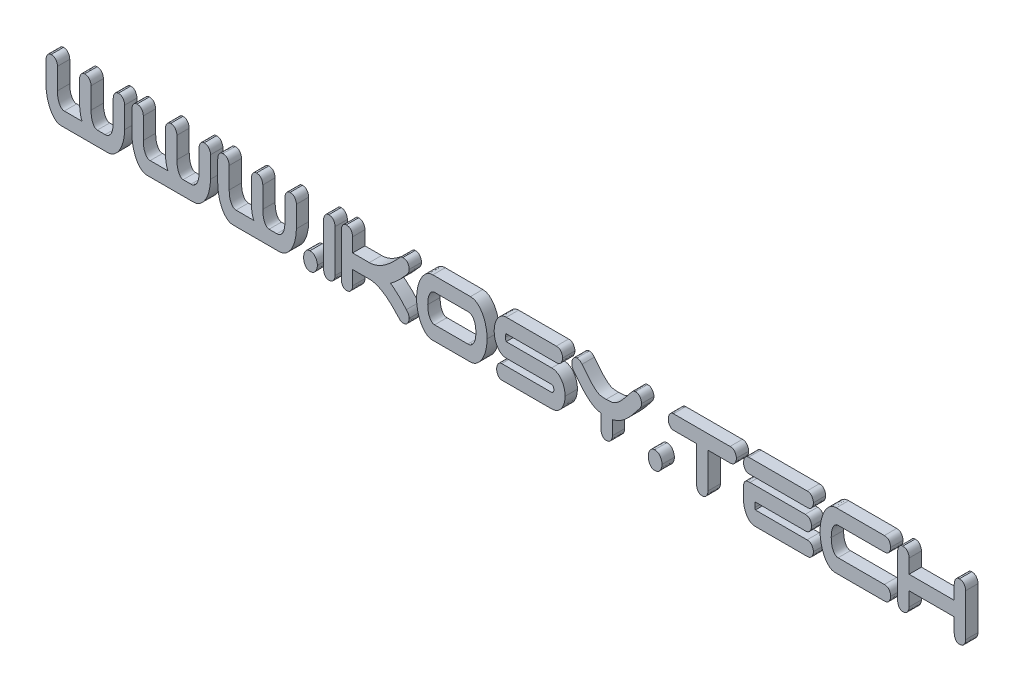
from build123d import *

# Parameters (mm, degrees)
TEXT_EXTRUDE_DEPTH    = 2.5
TEXT_EXTRUDE_2_DEPTH  = 2.5
TEXT_EXTRUDE_3_DEPTH  = 2.5
TEXT_EXTRUDE_4_DEPTH  = 2.5
TEXT_EXTRUDE_5_DEPTH  = 2.5
TEXT_EXTRUDE_6_DEPTH  = 2.5
TEXT_EXTRUDE_7_DEPTH  = 2.5
TEXT_EXTRUDE_8_DEPTH  = 2.5
TEXT_EXTRUDE_9_DEPTH  = 2.5
TEXT_EXTRUDE_10_DEPTH = 2.5
TEXT_EXTRUDE_11_DEPTH = 2.5
TEXT_EXTRUDE_12_DEPTH = 2.5
TEXT_EXTRUDE_13_DEPTH = 2.5
TEXT_EXTRUDE_14_DEPTH = 2.5
TEXT_EXTRUDE_15_DEPTH = 2.5


with BuildPart() as part:
    # Text Sketch → Text Extrude (new body)
    with BuildSketch(Plane.XY):
        with BuildLine():
            add(Edge.make_bspline(
                [(0.084737524, 11.141283215), (0.088352565, 11.235939531), (0.095355865, 11.41931408), (0.148829129, 11.685788598), (0.238517787, 11.933634344), (0.362789339, 12.158902666), (0.516878101, 12.348793883), (0.695846082, 12.494631077), (0.903677782, 12.580852986), (1.050389142, 12.590002964), (1.124432923, 12.594620868)],
                knots=[0, 0, 0, 0, 1.147004837, 2.222054497, 3.279664014, 4.331359947, 5.326320678, 6.227132309, 7.105251108, 8, 8, 8, 8], degree=3))
            add(Edge.make_bspline(
                [(1.124432923, 12.594620868), (1.22813478, 12.589229926), (1.424653741, 12.579013884), (1.700413205, 12.493113534), (1.92785693, 12.338397932), (2.101477364, 12.128612786), (2.230291729, 11.892537388), (2.32961037, 11.647779928), (2.392628094, 11.396609051), (2.399303907, 11.226101408), (2.402624757, 11.141283215)],
                knots=[0, 0, 0, 0, 1.145886374, 2.171498243, 3.151055978, 4.145252637, 5.154343752, 6.11639408, 7.063009444, 8, 8, 8, 8], degree=3))
            Line((2.402624757, 11.141283215), (2.402624757, 6.844620868))
            add(Edge.make_bspline(
                [(2.402624757, 6.844620868), (2.406998695, 6.680565458), (2.415998508, 6.343005117), (2.464729293, 5.835918727), (2.562383062, 5.337666998), (2.727443244, 4.887755853), (2.936044372, 4.511989202), (3.141615293, 4.257933398), (3.330789619, 4.120982482), (3.476577249, 4.049037775), (3.633761548, 4.006535388), (3.741428748, 4.0005978), (3.796338302, 3.997569669)],
                knots=[0, 0, 0, 0, 1.421369808, 2.924609886, 4.408157366, 5.807360525, 7.05526964, 8.123192616, 8.601024659, 9.067825495, 9.524597215, 10, 10, 10, 10], degree=3))
            Line((3.796338302, 3.997569669), (7.429682437, 3.997569669))
            add(Edge.make_bspline(
                [(7.429682437, 3.997569669), (7.386776385, 4.076177759), (7.295400142, 4.243587989), (7.191102799, 4.530216742), (7.097133195, 4.858622744), (7.001720747, 5.360754297), (6.915854345, 6.026960032), (6.90317026, 6.57103053), (6.896791964, 6.844620868)],
                knots=[0, 0, 0, 0, 0.550596351, 1.172595107, 1.872108015, 2.651894347, 4.316377452, 6, 6, 6, 6], degree=3))
            Line((6.896791964, 6.844620868), (6.896791964, 11.141283215))
            add(Edge.make_bspline(
                [(6.896791964, 11.141283215), (6.900407005, 11.235939531), (6.907410304, 11.41931408), (6.960883568, 11.685788598), (7.050572226, 11.933634344), (7.174843778, 12.158902666), (7.328932541, 12.348793883), (7.507900522, 12.494631077), (7.715732221, 12.580852986), (7.862443581, 12.590002964), (7.936487362, 12.594620868)],
                knots=[0, 0, 0, 0, 1.147004837, 2.222054497, 3.279664014, 4.331359947, 5.326320678, 6.227132309, 7.105251108, 8, 8, 8, 8], degree=3))
            add(Edge.make_bspline(
                [(7.936487362, 12.594620868), (8.038940978, 12.589123102), (8.234202286, 12.578645179), (8.508664879, 12.493072245), (8.736457532, 12.338553077), (8.909155664, 12.127536732), (9.043069559, 11.893654548), (9.141420368, 11.647640172), (9.204742512, 11.396643342), (9.211378271, 11.226112799), (9.214679196, 11.141283215)],
                knots=[0, 0, 0, 0, 1.133181501, 2.159674891, 3.140074562, 4.13512574, 5.151897891, 6.114775108, 7.062204094, 8, 8, 8, 8], degree=3))
            Line((9.214679196, 11.141283215), (9.214679196, 6.844620868))
            add(Edge.make_bspline(
                [(9.214679196, 6.844620868), (9.218969063, 6.681807686), (9.227732809, 6.349197491), (9.277176411, 5.849719318), (9.374934527, 5.356174848), (9.503528095, 4.966299997), (9.633740738, 4.683990271), (9.737082153, 4.501801097), (9.845831978, 4.346067703), (9.960563624, 4.217498195), (10.08422143, 4.119076319), (10.214377704, 4.049914121), (10.349855687, 4.007093627), (10.442892003, 4.000732213), (10.489144524, 3.997569669)],
                knots=[0, 0, 0, 0, 1.738006205, 3.550563757, 5.349787416, 7.098028101, 7.916568963, 8.664770571, 9.330559333, 9.940551626, 10.497527359, 11.007556249, 11.506611747, 12, 12, 12, 12], degree=3))
            Line((10.489144524, 3.997569669), (12.076636423, 3.997569669))
            add(Edge.make_bspline(
                [(12.076636423, 3.997569669), (12.153864587, 4.001566188), (12.302470375, 4.009256464), (12.515943266, 4.056390209), (12.704592772, 4.144279474), (12.928150675, 4.303487774), (13.162283373, 4.569497989), (13.383085656, 4.95340022), (13.545835463, 5.400047313), (13.640834764, 5.888402447), (13.695653063, 6.375053437), (13.704619951, 6.694196168), (13.708846403, 6.844620868)],
                knots=[0, 0, 0, 0, 0.636428735, 1.224643805, 1.787762638, 2.338474794, 3.475490099, 4.672300096, 5.970444146, 7.371112152, 8.760900289, 10, 10, 10, 10], degree=3))
            Line((13.708846403, 6.844620868), (13.708846403, 11.141283215))
            add(Edge.make_bspline(
                [(13.708846403, 11.141283215), (13.712461444, 11.235939531), (13.719464744, 11.41931408), (13.772938008, 11.685788598), (13.862626666, 11.933634344), (13.986898218, 12.158902666), (14.14098698, 12.348793883), (14.319954961, 12.494631077), (14.527786661, 12.580852986), (14.674498021, 12.590002964), (14.748541802, 12.594620868)],
                knots=[0, 0, 0, 0, 1.147004837, 2.222054497, 3.279664014, 4.331359947, 5.326320678, 6.227132309, 7.105251108, 8, 8, 8, 8], degree=3))
            add(Edge.make_bspline(
                [(14.748541802, 12.594620868), (14.850995418, 12.589123102), (15.046256725, 12.578645179), (15.320719319, 12.493072245), (15.548511971, 12.338553077), (15.721210104, 12.127536732), (15.855123998, 11.893654548), (15.953474807, 11.647640172), (16.016796951, 11.396643342), (16.02343271, 11.226112799), (16.026733636, 11.141283215)],
                knots=[0, 0, 0, 0, 1.133181501, 2.159674891, 3.140074562, 4.13512574, 5.151897891, 6.114775108, 7.062204094, 8, 8, 8, 8], degree=3))
            Line((16.026733636, 11.141283215), (16.026733636, 6.844620868))
            add(Edge.make_bspline(
                [(16.026733636, 6.844620868), (16.016489461, 6.526023552), (15.995597171, 5.87626621), (15.85735497, 5.069576423), (15.700601674, 4.430075667), (15.560260799, 3.964466993), (15.388495715, 3.523328366), (15.194095749, 3.103366717), (14.976593876, 2.706137232), (14.720625915, 2.33874133), (14.43195493, 1.998538348), (14.116680531, 1.686695974), (13.766603739, 1.416928465), (13.368554403, 1.231174498), (12.934188863, 1.113737221), (12.631430091, 1.101122925), (12.475372651, 1.094620868)],
                knots=[0, 0, 0, 0, 1.799801224, 3.670570972, 4.610410242, 5.520845599, 6.416464605, 7.283311826, 8.134931654, 8.972283627, 9.809105761, 10.653023461, 11.475770373, 12.292173682, 13.11969849, 14, 14, 14, 14], degree=3))
            Line((12.475372651, 1.094620868), (3.229909268, 1.094620868))
            add(Edge.make_bspline(
                [(3.229909268, 1.094620868), (3.102381775, 1.100352979), (2.851506324, 1.111629337), (2.49022145, 1.223212658), (2.1537058, 1.394768889), (1.850696514, 1.640814248), (1.575982747, 1.93476473), (1.321480935, 2.265145564), (1.089382239, 2.629115796), (0.881394693, 3.026951083), (0.702328527, 3.456659083), (0.536626009, 3.905605612), (0.399680486, 4.378043679), (0.247255062, 5.028825565), (0.117382418, 5.853395361), (0.095513516, 6.51741999), (0.084737524, 6.844620868)],
                knots=[0, 0, 0, 0, 0.74818093, 1.47184129, 2.203863704, 2.958156395, 3.754085872, 4.566677148, 5.407838898, 6.290259488, 7.203628613, 8.144381123, 9.103901089, 10.094628626, 12.075612124, 14, 14, 14, 14], degree=3))
            Line((0.084737524, 6.844620868), (0.084737524, 11.141283215))
        make_face()
    extrude(amount=TEXT_EXTRUDE_DEPTH)


with BuildPart() as body_2:
    # Text Sketch → Text Extrude 2 (new body)
    with BuildSketch(Plane.XY):
        with BuildLine():
            add(Edge.make_bspline(
                [(17.494977317, 11.141283215), (17.498592358, 11.235939531), (17.505595657, 11.41931408), (17.559068922, 11.685788598), (17.64875758, 11.933634344), (17.773029132, 12.158902666), (17.927117894, 12.348793883), (18.106085875, 12.494631077), (18.313917575, 12.580852986), (18.460628935, 12.590002964), (18.534672715, 12.594620868)],
                knots=[0, 0, 0, 0, 1.147004837, 2.222054497, 3.279664014, 4.331359947, 5.326320678, 6.227132309, 7.105251108, 8, 8, 8, 8], degree=3))
            add(Edge.make_bspline(
                [(18.534672715, 12.594620868), (18.638374572, 12.589229926), (18.834893533, 12.579013884), (19.110652998, 12.493113534), (19.338096723, 12.338397932), (19.511717156, 12.128612786), (19.640531521, 11.892537388), (19.739850162, 11.647779928), (19.802867887, 11.396609051), (19.809543699, 11.226101408), (19.81286455, 11.141283215)],
                knots=[0, 0, 0, 0, 1.145886374, 2.171498243, 3.151055978, 4.145252637, 5.154343752, 6.11639408, 7.063009444, 8, 8, 8, 8], degree=3))
            Line((19.81286455, 11.141283215), (19.81286455, 6.844620868))
            add(Edge.make_bspline(
                [(19.81286455, 6.844620868), (19.817238487, 6.680565458), (19.8262383, 6.343005117), (19.874969085, 5.835918727), (19.972622855, 5.337666998), (20.137683036, 4.887755853), (20.346284164, 4.511989202), (20.551855085, 4.257933398), (20.741029411, 4.120982482), (20.886817041, 4.049037775), (21.04400134, 4.006535388), (21.15166854, 4.0005978), (21.206578095, 3.997569669)],
                knots=[0, 0, 0, 0, 1.421369808, 2.924609886, 4.408157366, 5.807360525, 7.05526964, 8.123192616, 8.601024659, 9.067825495, 9.524597215, 10, 10, 10, 10], degree=3))
            Line((21.206578095, 3.997569669), (24.839922229, 3.997569669))
            add(Edge.make_bspline(
                [(24.839922229, 3.997569669), (24.797016178, 4.076177759), (24.705639934, 4.243587989), (24.601342591, 4.530216742), (24.507372988, 4.858622744), (24.41196054, 5.360754297), (24.326094138, 6.026960032), (24.313410053, 6.57103053), (24.307031756, 6.844620868)],
                knots=[0, 0, 0, 0, 0.550596351, 1.172595107, 1.872108015, 2.651894347, 4.316377452, 6, 6, 6, 6], degree=3))
            Line((24.307031756, 6.844620868), (24.307031756, 11.141283215))
            add(Edge.make_bspline(
                [(24.307031756, 11.141283215), (24.310646797, 11.235939531), (24.317650097, 11.41931408), (24.371123361, 11.685788598), (24.460812019, 11.933634344), (24.585083571, 12.158902666), (24.739172333, 12.348793883), (24.918140314, 12.494631077), (25.125972014, 12.580852986), (25.272683374, 12.590002964), (25.346727155, 12.594620868)],
                knots=[0, 0, 0, 0, 1.147004837, 2.222054497, 3.279664014, 4.331359947, 5.326320678, 6.227132309, 7.105251108, 8, 8, 8, 8], degree=3))
            add(Edge.make_bspline(
                [(25.346727155, 12.594620868), (25.449180771, 12.589123102), (25.644442078, 12.578645179), (25.918904672, 12.493072245), (26.146697324, 12.338553077), (26.319395457, 12.127536732), (26.453309351, 11.893654548), (26.551660161, 11.647640172), (26.614982304, 11.396643342), (26.621618063, 11.226112799), (26.624918989, 11.141283215)],
                knots=[0, 0, 0, 0, 1.133181501, 2.159674891, 3.140074562, 4.13512574, 5.151897891, 6.114775108, 7.062204094, 8, 8, 8, 8], degree=3))
            Line((26.624918989, 11.141283215), (26.624918989, 6.844620868))
            add(Edge.make_bspline(
                [(26.624918989, 6.844620868), (26.629208856, 6.681807686), (26.637972601, 6.349197491), (26.687416204, 5.849719318), (26.785174319, 5.356174848), (26.913767888, 4.966299997), (27.043980531, 4.683990271), (27.147321946, 4.501801097), (27.25607177, 4.346067703), (27.370803417, 4.217498195), (27.494461222, 4.119076319), (27.624617496, 4.049914121), (27.760095479, 4.007093627), (27.853131795, 4.000732213), (27.899384316, 3.997569669)],
                knots=[0, 0, 0, 0, 1.738006205, 3.550563757, 5.349787416, 7.098028101, 7.916568963, 8.664770571, 9.330559333, 9.940551626, 10.497527359, 11.007556249, 11.506611747, 12, 12, 12, 12], degree=3))
            Line((27.899384316, 3.997569669), (29.486876215, 3.997569669))
            add(Edge.make_bspline(
                [(29.486876215, 3.997569669), (29.56410438, 4.001566188), (29.712710167, 4.009256464), (29.926183058, 4.056390209), (30.114832565, 4.144279474), (30.338390468, 4.303487774), (30.572523165, 4.569497989), (30.793325448, 4.95340022), (30.956075256, 5.400047313), (31.051074557, 5.888402447), (31.105892855, 6.375053437), (31.114859744, 6.694196168), (31.119086196, 6.844620868)],
                knots=[0, 0, 0, 0, 0.636428735, 1.224643805, 1.787762638, 2.338474794, 3.475490099, 4.672300096, 5.970444146, 7.371112152, 8.760900289, 10, 10, 10, 10], degree=3))
            Line((31.119086196, 6.844620868), (31.119086196, 11.141283215))
            add(Edge.make_bspline(
                [(31.119086196, 11.141283215), (31.122701237, 11.235939531), (31.129704536, 11.41931408), (31.1831778, 11.685788598), (31.272866458, 11.933634344), (31.39713801, 12.158902666), (31.551226773, 12.348793883), (31.730194754, 12.494631077), (31.938026453, 12.580852986), (32.084737813, 12.590002964), (32.158781594, 12.594620868)],
                knots=[0, 0, 0, 0, 1.147004837, 2.222054497, 3.279664014, 4.331359947, 5.326320678, 6.227132309, 7.105251108, 8, 8, 8, 8], degree=3))
            add(Edge.make_bspline(
                [(32.158781594, 12.594620868), (32.26123521, 12.589123102), (32.456496518, 12.578645179), (32.730959111, 12.493072245), (32.958751764, 12.338553077), (33.131449896, 12.127536732), (33.265363791, 11.893654548), (33.3637146, 11.647640172), (33.427036744, 11.396643342), (33.433672503, 11.226112799), (33.436973428, 11.141283215)],
                knots=[0, 0, 0, 0, 1.133181501, 2.159674891, 3.140074562, 4.13512574, 5.151897891, 6.114775108, 7.062204094, 8, 8, 8, 8], degree=3))
            Line((33.436973428, 11.141283215), (33.436973428, 6.844620868))
            add(Edge.make_bspline(
                [(33.436973428, 6.844620868), (33.426729254, 6.526023552), (33.405836964, 5.87626621), (33.267594762, 5.069576423), (33.110841467, 4.430075667), (32.970500592, 3.964466993), (32.798735508, 3.523328366), (32.604335542, 3.103366717), (32.386833669, 2.706137232), (32.130865708, 2.33874133), (31.842194723, 1.998538348), (31.526920324, 1.686695974), (31.176843532, 1.416928465), (30.778794196, 1.231174498), (30.344428656, 1.113737221), (30.041669884, 1.101122925), (29.885612443, 1.094620868)],
                knots=[0, 0, 0, 0, 1.799801224, 3.670570972, 4.610410242, 5.520845599, 6.416464605, 7.283311826, 8.134931654, 8.972283627, 9.809105761, 10.653023461, 11.475770373, 12.292173682, 13.11969849, 14, 14, 14, 14], degree=3))
            Line((29.885612443, 1.094620868), (20.64014906, 1.094620868))
            add(Edge.make_bspline(
                [(20.64014906, 1.094620868), (20.512621568, 1.100352979), (20.261746116, 1.111629337), (19.900461243, 1.223212658), (19.563945592, 1.394768889), (19.260936307, 1.640814248), (18.98622254, 1.93476473), (18.731720728, 2.265145564), (18.499622031, 2.629115796), (18.291634486, 3.026951083), (18.112568319, 3.456659083), (17.946865802, 3.905605612), (17.809920279, 4.378043679), (17.657494854, 5.028825565), (17.527622211, 5.853395361), (17.505753309, 6.51741999), (17.494977317, 6.844620868)],
                knots=[0, 0, 0, 0, 0.74818093, 1.47184129, 2.203863704, 2.958156395, 3.754085872, 4.566677148, 5.407838898, 6.290259488, 7.203628613, 8.144381123, 9.103901089, 10.094628626, 12.075612124, 14, 14, 14, 14], degree=3))
            Line((17.494977317, 6.844620868), (17.494977317, 11.141283215))
        make_face()
    extrude(amount=TEXT_EXTRUDE_2_DEPTH)


with BuildPart() as body_3:
    # Text Sketch → Text Extrude 3 (new body)
    with BuildSketch(Plane.XY):
        with BuildLine():
            add(Edge.make_bspline(
                [(34.90521711, 11.141283215), (34.908832151, 11.235939531), (34.91583545, 11.41931408), (34.969308714, 11.685788598), (35.058997372, 11.933634344), (35.183268924, 12.158902666), (35.337357687, 12.348793883), (35.516325667, 12.494631077), (35.724157367, 12.580852986), (35.870868727, 12.590002964), (35.944912508, 12.594620868)],
                knots=[0, 0, 0, 0, 1.147004837, 2.222054497, 3.279664014, 4.331359947, 5.326320678, 6.227132309, 7.105251108, 8, 8, 8, 8], degree=3))
            add(Edge.make_bspline(
                [(35.944912508, 12.594620868), (36.048614365, 12.589229926), (36.245133326, 12.579013884), (36.52089279, 12.493113534), (36.748336516, 12.338397932), (36.921956949, 12.128612786), (37.050771314, 11.892537388), (37.150089955, 11.647779928), (37.21310768, 11.396609051), (37.219783492, 11.226101408), (37.223104342, 11.141283215)],
                knots=[0, 0, 0, 0, 1.145886374, 2.171498243, 3.151055978, 4.145252637, 5.154343752, 6.11639408, 7.063009444, 8, 8, 8, 8], degree=3))
            Line((37.223104342, 11.141283215), (37.223104342, 6.844620868))
            add(Edge.make_bspline(
                [(37.223104342, 6.844620868), (37.22747828, 6.680565458), (37.236478093, 6.343005117), (37.285208878, 5.835918727), (37.382862647, 5.337666998), (37.547922829, 4.887755853), (37.756523957, 4.511989202), (37.962094878, 4.257933398), (38.151269204, 4.120982482), (38.297056834, 4.049037775), (38.454241133, 4.006535388), (38.561908333, 4.0005978), (38.616817887, 3.997569669)],
                knots=[0, 0, 0, 0, 1.421369808, 2.924609886, 4.408157366, 5.807360525, 7.05526964, 8.123192616, 8.601024659, 9.067825495, 9.524597215, 10, 10, 10, 10], degree=3))
            Line((38.616817887, 3.997569669), (42.250162022, 3.997569669))
            add(Edge.make_bspline(
                [(42.250162022, 3.997569669), (42.20725597, 4.076177759), (42.115879727, 4.243587989), (42.011582384, 4.530216742), (41.917612781, 4.858622744), (41.822200332, 5.360754297), (41.736333931, 6.026960032), (41.723649846, 6.57103053), (41.717271549, 6.844620868)],
                knots=[0, 0, 0, 0, 0.550596351, 1.172595107, 1.872108015, 2.651894347, 4.316377452, 6, 6, 6, 6], degree=3))
            Line((41.717271549, 6.844620868), (41.717271549, 11.141283215))
            add(Edge.make_bspline(
                [(41.717271549, 11.141283215), (41.72088659, 11.235939531), (41.727889889, 11.41931408), (41.781363154, 11.685788598), (41.871051812, 11.933634344), (41.995323364, 12.158902666), (42.149412126, 12.348793883), (42.328380107, 12.494631077), (42.536211807, 12.580852986), (42.682923167, 12.590002964), (42.756966948, 12.594620868)],
                knots=[0, 0, 0, 0, 1.147004837, 2.222054497, 3.279664014, 4.331359947, 5.326320678, 6.227132309, 7.105251108, 8, 8, 8, 8], degree=3))
            add(Edge.make_bspline(
                [(42.756966948, 12.594620868), (42.859420563, 12.589123102), (43.054681871, 12.578645179), (43.329144465, 12.493072245), (43.556937117, 12.338553077), (43.72963525, 12.127536732), (43.863549144, 11.893654548), (43.961899953, 11.647640172), (44.025222097, 11.396643342), (44.031857856, 11.226112799), (44.035158782, 11.141283215)],
                knots=[0, 0, 0, 0, 1.133181501, 2.159674891, 3.140074562, 4.13512574, 5.151897891, 6.114775108, 7.062204094, 8, 8, 8, 8], degree=3))
            Line((44.035158782, 11.141283215), (44.035158782, 6.844620868))
            add(Edge.make_bspline(
                [(44.035158782, 6.844620868), (44.039448648, 6.681807686), (44.048212394, 6.349197491), (44.097655996, 5.849719318), (44.195414112, 5.356174848), (44.32400768, 4.966299997), (44.454220324, 4.683990271), (44.557561739, 4.501801097), (44.666311563, 4.346067703), (44.781043209, 4.217498195), (44.904701015, 4.119076319), (45.034857289, 4.049914121), (45.170335272, 4.007093627), (45.263371588, 4.000732213), (45.309624109, 3.997569669)],
                knots=[0, 0, 0, 0, 1.738006205, 3.550563757, 5.349787416, 7.098028101, 7.916568963, 8.664770571, 9.330559333, 9.940551626, 10.497527359, 11.007556249, 11.506611747, 12, 12, 12, 12], degree=3))
            Line((45.309624109, 3.997569669), (46.897116008, 3.997569669))
            add(Edge.make_bspline(
                [(46.897116008, 3.997569669), (46.974344172, 4.001566188), (47.12294996, 4.009256464), (47.336422851, 4.056390209), (47.525072357, 4.144279474), (47.748630261, 4.303487774), (47.982762958, 4.569497989), (48.203565241, 4.95340022), (48.366315048, 5.400047313), (48.461314349, 5.888402447), (48.516132648, 6.375053437), (48.525099536, 6.694196168), (48.529325988, 6.844620868)],
                knots=[0, 0, 0, 0, 0.636428735, 1.224643805, 1.787762638, 2.338474794, 3.475490099, 4.672300096, 5.970444146, 7.371112152, 8.760900289, 10, 10, 10, 10], degree=3))
            Line((48.529325988, 6.844620868), (48.529325988, 11.141283215))
            add(Edge.make_bspline(
                [(48.529325988, 11.141283215), (48.532941029, 11.235939531), (48.539944329, 11.41931408), (48.593417593, 11.685788598), (48.683106251, 11.933634344), (48.807377803, 12.158902666), (48.961466565, 12.348793883), (49.140434546, 12.494631077), (49.348266246, 12.580852986), (49.494977606, 12.590002964), (49.569021387, 12.594620868)],
                knots=[0, 0, 0, 0, 1.147004837, 2.222054497, 3.279664014, 4.331359947, 5.326320678, 6.227132309, 7.105251108, 8, 8, 8, 8], degree=3))
            add(Edge.make_bspline(
                [(49.569021387, 12.594620868), (49.671475003, 12.589123102), (49.86673631, 12.578645179), (50.141198904, 12.493072245), (50.368991556, 12.338553077), (50.541689689, 12.127536732), (50.675603583, 11.893654548), (50.773954393, 11.647640172), (50.837276537, 11.396643342), (50.843912295, 11.226112799), (50.847213221, 11.141283215)],
                knots=[0, 0, 0, 0, 1.133181501, 2.159674891, 3.140074562, 4.13512574, 5.151897891, 6.114775108, 7.062204094, 8, 8, 8, 8], degree=3))
            Line((50.847213221, 11.141283215), (50.847213221, 6.844620868))
            add(Edge.make_bspline(
                [(50.847213221, 6.844620868), (50.836969046, 6.526023552), (50.816076756, 5.87626621), (50.677834555, 5.069576423), (50.521081259, 4.430075667), (50.380740384, 3.964466993), (50.2089753, 3.523328366), (50.014575334, 3.103366717), (49.797073461, 2.706137232), (49.541105501, 2.33874133), (49.252434515, 1.998538348), (48.937160116, 1.686695974), (48.587083324, 1.416928465), (48.189033988, 1.231174498), (47.754668449, 1.113737221), (47.451909677, 1.101122925), (47.295852236, 1.094620868)],
                knots=[0, 0, 0, 0, 1.799801224, 3.670570972, 4.610410242, 5.520845599, 6.416464605, 7.283311826, 8.134931654, 8.972283627, 9.809105761, 10.653023461, 11.475770373, 12.292173682, 13.11969849, 14, 14, 14, 14], degree=3))
            Line((47.295852236, 1.094620868), (38.050388853, 1.094620868))
            add(Edge.make_bspline(
                [(38.050388853, 1.094620868), (37.922861361, 1.100352979), (37.671985909, 1.111629337), (37.310701036, 1.223212658), (36.974185385, 1.394768889), (36.671176099, 1.640814248), (36.396462333, 1.93476473), (36.141960521, 2.265145564), (35.909861824, 2.629115796), (35.701874278, 3.026951083), (35.522808112, 3.456659083), (35.357105595, 3.905605612), (35.220160071, 4.378043679), (35.067734647, 5.028825565), (34.937862003, 5.853395361), (34.915993101, 6.51741999), (34.90521711, 6.844620868)],
                knots=[0, 0, 0, 0, 0.74818093, 1.47184129, 2.203863704, 2.958156395, 3.754085872, 4.566677148, 5.407838898, 6.290259488, 7.203628613, 8.144381123, 9.103901089, 10.094628626, 12.075612124, 14, 14, 14, 14], degree=3))
            Line((34.90521711, 6.844620868), (34.90521711, 11.141283215))
        make_face()
    extrude(amount=TEXT_EXTRUDE_3_DEPTH)


with BuildPart() as body_4:
    # Text Sketch → Text Extrude 4 (new body)
    with BuildSketch(Plane.XY):
        with BuildLine():
            add(Edge.make_bspline(
                [(52.315456902, 2.547958522), (52.319312687, 2.666360199), (52.326806847, 2.896487485), (52.397756566, 3.228210122), (52.503117191, 3.538479878), (52.659753402, 3.814018691), (52.844419429, 4.051104175), (53.066852984, 4.226485105), (53.320254788, 4.332930712), (53.499513453, 4.34533283), (53.589922229, 4.351587816)],
                knots=[0, 0, 0, 0, 1.160345278, 2.255264598, 3.315503269, 4.363336114, 5.351392794, 6.246249024, 7.115498931, 8, 8, 8, 8], degree=3))
            add(Edge.make_bspline(
                [(53.589922229, 4.351587816), (53.708673818, 4.344408069), (53.936319818, 4.330644542), (54.256464892, 4.226247077), (54.524175357, 4.038369954), (54.732065074, 3.784314334), (54.89582082, 3.497413874), (55.017624257, 3.19155068), (55.09069188, 2.873133089), (55.098818261, 2.656395225), (55.102883992, 2.547958522)],
                knots=[0, 0, 0, 0, 1.081536768, 2.073298739, 3.024956809, 4.020910659, 5.040460596, 6.026519013, 7.012642428, 8, 8, 8, 8], degree=3))
            add(Edge.make_bspline(
                [(55.102883992, 2.547958522), (55.098936746, 2.438258837), (55.091091777, 2.220235823), (55.016905037, 1.899659931), (54.896628748, 1.592059151), (54.733166191, 1.304381608), (54.522832421, 1.053758671), (54.256618415, 0.865809806), (53.936276638, 0.761583588), (53.708659015, 0.747795356), (53.589922229, 0.740602722)],
                knots=[0, 0, 0, 0, 0.997003298, 1.981497619, 2.976448412, 3.994314034, 4.980040474, 5.930126388, 6.92024995, 8, 8, 8, 8], degree=3))
            add(Edge.make_bspline(
                [(53.589922229, 0.740602722), (53.498081661, 0.746402171), (53.318356261, 0.757751275), (53.066911127, 0.868319304), (52.839734641, 1.035497452), (52.655870695, 1.273971162), (52.502924744, 1.551891487), (52.398228962, 1.862879045), (52.326483356, 2.196909235), (52.319215291, 2.428302653), (52.315456902, 2.547958522)],
                knots=[0, 0, 0, 0, 0.89426037, 1.750003366, 2.644842091, 3.630322595, 4.669537068, 5.738481425, 6.830545944, 8, 8, 8, 8], degree=3))
        make_face()
    extrude(amount=TEXT_EXTRUDE_4_DEPTH)


with BuildPart() as body_5:
    # Text Sketch → Text Extrude 5 (new body)
    with BuildSketch(Plane.XY):
        with BuildLine():
            add(Edge.make_bspline(
                [(58.687783539, 2.547958522), (58.684550232, 2.461887332), (58.678097497, 2.290114416), (58.614755808, 2.037752568), (58.515498541, 1.792907575), (58.386449469, 1.557178065), (58.214138103, 1.34665418), (57.984277508, 1.196844709), (57.709994368, 1.109958936), (57.513356374, 1.099918922), (57.409591704, 1.094620868)],
                knots=[0, 0, 0, 0, 0.94997657, 1.895875329, 2.857197367, 3.865524581, 4.858968616, 5.830145621, 6.854981083, 8, 8, 8, 8], degree=3))
            add(Edge.make_bspline(
                [(57.409591704, 1.094620868), (57.334235864, 1.09903586), (57.186140668, 1.107712546), (56.978530073, 1.195042981), (56.797289995, 1.336452622), (56.643797629, 1.525875171), (56.524495883, 1.75294414), (56.433112091, 2.00070549), (56.380951083, 2.268804417), (56.373643504, 2.453334661), (56.369896306, 2.547958522)],
                knots=[0, 0, 0, 0, 0.908202067, 1.784869782, 2.674971349, 3.668287915, 4.711008848, 5.766870674, 6.85489058, 8, 8, 8, 8], degree=3))
            Line((56.369896306, 2.547958522), (56.369896306, 11.141283215))
            add(Edge.make_bspline(
                [(56.369896306, 11.141283215), (56.373511347, 11.235939531), (56.380514646, 11.41931408), (56.433987911, 11.685788598), (56.523676569, 11.933634344), (56.647948121, 12.158902666), (56.802036883, 12.348793883), (56.981004864, 12.494631077), (57.188836564, 12.580852986), (57.335547924, 12.590002964), (57.409591704, 12.594620868)],
                knots=[0, 0, 0, 0, 1.147004837, 2.222054497, 3.279664014, 4.331359947, 5.326320678, 6.227132309, 7.105251108, 8, 8, 8, 8], degree=3))
            add(Edge.make_bspline(
                [(57.409591704, 12.594620868), (57.513293561, 12.589229926), (57.709812522, 12.579013884), (57.985571987, 12.493113534), (58.213015712, 12.338397932), (58.386636145, 12.128612786), (58.51545051, 11.892537388), (58.614769151, 11.647779928), (58.677786876, 11.396609051), (58.684462688, 11.226101408), (58.687783539, 11.141283215)],
                knots=[0, 0, 0, 0, 1.145886374, 2.171498243, 3.151055978, 4.145252637, 5.154343752, 6.11639408, 7.063009444, 8, 8, 8, 8], degree=3))
            Line((58.687783539, 11.141283215), (58.687783539, 2.547958522))
        make_face()
    extrude(amount=TEXT_EXTRUDE_5_DEPTH)


with BuildPart() as body_6:
    # Text Sketch → Text Extrude 6 (new body)
    with BuildSketch(Plane.XY):
        with BuildLine():
            Line((62.250324044, 8.297958522), (65.626539209, 8.297958522))
            add(Edge.make_bspline(
                [(65.626539209, 8.297958522), (65.763352764, 8.302945272), (66.03698551, 8.312918975), (66.446016283, 8.372526416), (66.850282877, 8.480008488), (67.393116703, 8.671863604), (68.064198562, 8.996784237), (68.839343862, 9.489597643), (69.593610376, 10.059325812), (70.307602178, 10.713991813), (71.006802628, 11.414613601), (71.460147851, 11.906148854), (71.689565781, 12.154893065)],
                knots=[0, 0, 0, 0, 0.555923698, 1.111870299, 1.674894669, 2.252652207, 3.448967243, 4.693708672, 5.979538165, 7.28373421, 8.625418241, 10, 10, 10, 10], degree=3))
            add(Edge.make_bspline(
                [(71.689565781, 12.154893065), (71.746719342, 12.222066453), (71.854108377, 12.348282302), (72.043452081, 12.48847091), (72.23836649, 12.579462813), (72.373129599, 12.589664959), (72.438593649, 12.594620868)],
                knots=[0, 0, 0, 0, 1.174655633, 2.207126415, 3.129073488, 4, 4, 4, 4], degree=3))
            add(Edge.make_bspline(
                [(72.438593649, 12.594620868), (72.542295506, 12.589229926), (72.738814467, 12.579013884), (73.014573931, 12.493113534), (73.242017656, 12.338397932), (73.41563809, 12.128612786), (73.544452455, 11.892537388), (73.643771096, 11.647779928), (73.70678882, 11.396609051), (73.713464633, 11.226101408), (73.716785483, 11.141283215)],
                knots=[0, 0, 0, 0, 1.145886374, 2.171498243, 3.151055978, 4.145252637, 5.154343752, 6.11639408, 7.063009444, 8, 8, 8, 8], degree=3))
            add(Edge.make_bspline(
                [(73.716785483, 11.141283215), (73.710175375, 11.027188886), (73.697353213, 10.805870886), (73.578481898, 10.488495446), (73.387309144, 10.187854134), (73.226319208, 9.99890582), (73.139176928, 9.896629942)],
                knots=[0, 0, 0, 0, 0.97070442, 1.882953905, 2.854063618, 4, 4, 4, 4], degree=3))
            add(Edge.make_bspline(
                [(73.139176928, 9.896629942), (73.000565867, 9.734704207), (72.732081064, 9.421059693), (72.335260096, 8.974458373), (71.953189805, 8.567375798), (71.567659662, 8.190945419), (71.153761963, 7.811801999), (70.780275663, 7.493197861), (70.467072193, 7.244553863), (70.255621514, 7.077015044), (70.066009093, 6.947674225), (69.947027473, 6.874073998), (69.893389501, 6.840894362)],
                knots=[0, 0, 0, 0, 1.429198024, 2.76830686, 4.00560822, 5.171790262, 6.380302347, 7.768852966, 8.462165869, 9.061913282, 9.577102168, 10, 10, 10, 10], degree=3))
            add(Edge.make_bspline(
                [(69.893389501, 6.840894362), (70.026777918, 6.756353533), (70.309734718, 6.577017106), (70.716501362, 6.245217289), (71.144827854, 5.883586095), (71.565944987, 5.490265787), (71.977245919, 5.097435173), (72.358165504, 4.683141627), (72.744281524, 4.250795805), (73.005378558, 3.950685644), (73.142903435, 3.792611795)],
                knots=[0, 0, 0, 0, 0.846905687, 1.796540712, 2.813290178, 3.8560258, 4.888565996, 5.86499491, 6.875451368, 8, 8, 8, 8], degree=3))
            add(Edge.make_bspline(
                [(73.142903435, 3.792611795), (73.229286362, 3.69312522), (73.391776613, 3.505986408), (73.576455931, 3.201973267), (73.697683325, 2.88357558), (73.710287666, 2.662122492), (73.716785483, 2.547958522)],
                knots=[0, 0, 0, 0, 1.124204507, 2.114680268, 3.028075944, 4, 4, 4, 4], degree=3))
            add(Edge.make_bspline(
                [(73.716785483, 2.547958522), (73.713552176, 2.461887332), (73.707099441, 2.290114416), (73.643757752, 2.037752568), (73.544500485, 1.792907575), (73.415451413, 1.557178065), (73.243140048, 1.34665418), (73.013279452, 1.196844709), (72.738996312, 1.109958936), (72.542358318, 1.099918922), (72.438593649, 1.094620868)],
                knots=[0, 0, 0, 0, 0.94997657, 1.895875329, 2.857197367, 3.865524581, 4.858968616, 5.830145621, 6.854981083, 8, 8, 8, 8], degree=3))
            add(Edge.make_bspline(
                [(72.438593649, 1.094620868), (72.371742518, 1.099192245), (72.236582523, 1.108434679), (72.043943004, 1.202342576), (71.854156674, 1.335501852), (71.748986248, 1.460631898), (71.693292288, 1.526895658)],
                knots=[0, 0, 0, 0, 0.894537412, 1.808580788, 2.839513922, 4, 4, 4, 4], degree=3))
            add(Edge.make_bspline(
                [(71.693292288, 1.526895658), (71.466363237, 1.774392428), (71.01325026, 2.26857331), (70.310029177, 2.976354593), (69.58951543, 3.641523697), (68.954121537, 4.128116986), (68.437201107, 4.47704405), (68.046809883, 4.707939804), (67.651076878, 4.909667356), (67.252265102, 5.082361249), (66.850167403, 5.220793367), (66.445473166, 5.322963959), (66.037153072, 5.385007937), (65.763387929, 5.391676343), (65.626539209, 5.395009721)],
                knots=[0, 0, 0, 0, 1.63305565, 3.260749131, 4.851847049, 6.398635549, 7.147663603, 7.884382876, 8.603119971, 9.306793234, 9.996529955, 10.669118359, 11.334723743, 12, 12, 12, 12], degree=3))
            Line((65.626539209, 5.395009721), (62.250324044, 5.395009721))
            Line((62.250324044, 5.395009721), (62.250324044, 2.547958522))
            add(Edge.make_bspline(
                [(62.250324044, 2.547958522), (62.247110576, 2.461876438), (62.240697433, 2.290081779), (62.177058175, 2.037883345), (62.078738407, 1.791825046), (61.944707244, 1.558119436), (61.773538588, 1.347803329), (61.547146592, 1.196756671), (61.278706012, 1.110745286), (61.087046012, 1.100149649), (60.987038237, 1.094620868)],
                knots=[0, 0, 0, 0, 0.956995596, 1.909883251, 2.878308143, 3.900938487, 4.901722713, 5.868565532, 6.887822087, 8, 8, 8, 8], degree=3))
            add(Edge.make_bspline(
                [(60.987038237, 1.094620868), (60.911682397, 1.09903586), (60.763587201, 1.107712546), (60.555976605, 1.195042981), (60.374736528, 1.336452622), (60.221244161, 1.525875171), (60.101942415, 1.75294414), (60.010558624, 2.00070549), (59.958397615, 2.268804417), (59.951090036, 2.453334661), (59.947342839, 2.547958522)],
                knots=[0, 0, 0, 0, 0.908202067, 1.784869782, 2.674971349, 3.668287915, 4.711008848, 5.766870674, 6.85489058, 8, 8, 8, 8], degree=3))
            Line((59.947342839, 2.547958522), (59.947342839, 11.141283215))
            add(Edge.make_bspline(
                [(59.947342839, 11.141283215), (59.950951795, 11.235944839), (59.957943306, 11.419329671), (60.011500291, 11.68573116), (60.100880695, 11.93384579), (60.225890186, 12.157448768), (60.375506826, 12.350160474), (60.553421469, 12.492235387), (60.755755918, 12.581670493), (60.89919169, 12.590255293), (60.97213221, 12.594620868)],
                knots=[0, 0, 0, 0, 1.154549111, 2.236669769, 3.301235575, 4.359848899, 5.351786401, 6.258523002, 7.114417303, 8, 8, 8, 8], degree=3))
            add(Edge.make_bspline(
                [(60.97213221, 12.594620868), (61.074585826, 12.589123102), (61.269847133, 12.578645179), (61.544309727, 12.493072245), (61.772102379, 12.338553077), (61.944800512, 12.127536732), (62.078714406, 11.893654548), (62.177065216, 11.647640172), (62.24038736, 11.396643342), (62.247023118, 11.226112799), (62.250324044, 11.141283215)],
                knots=[0, 0, 0, 0, 1.133181501, 2.159674891, 3.140074562, 4.13512574, 5.151897891, 6.114775108, 7.062204094, 8, 8, 8, 8], degree=3))
            Line((62.250324044, 11.141283215), (62.250324044, 8.297958522))
        make_face()
    extrude(amount=TEXT_EXTRUDE_6_DEPTH)


with BuildPart() as body_7:
    # Text Sketch → Text Extrude 7 (new body)
    with BuildSketch(Plane.XY):
        with BuildLine():
            add(Edge.make_bspline(
                [(89.517174336, 6.844620868), (89.506930161, 6.526023552), (89.486037871, 5.87626621), (89.34779567, 5.069576423), (89.191042374, 4.430075667), (89.050701499, 3.964466993), (88.878936415, 3.523328366), (88.684536449, 3.103366717), (88.467034576, 2.706137232), (88.211066615, 2.33874133), (87.92239563, 1.998538348), (87.607121231, 1.686695974), (87.257044439, 1.416928465), (86.858995103, 1.231174498), (86.424629563, 1.113737221), (86.121870791, 1.101122925), (85.965813351, 1.094620868)],
                knots=[0, 0, 0, 0, 1.799801224, 3.670570972, 4.610410242, 5.520845599, 6.416464605, 7.283311826, 8.134931654, 8.972283627, 9.809105761, 10.653023461, 11.475770373, 12.292173682, 13.11969849, 14, 14, 14, 14], degree=3))
            Line((85.965813351, 1.094620868), (78.345106935, 1.094620868))
            add(Edge.make_bspline(
                [(78.345106935, 1.094620868), (78.218544772, 1.109471153), (77.967101845, 1.138974434), (77.60996162, 1.272310356), (77.275367298, 1.460876416), (76.971790344, 1.714102637), (76.694421638, 2.012831556), (76.442827889, 2.34630973), (76.208115204, 2.705244851), (76.006062969, 3.097968886), (75.823540092, 3.515116418), (75.664224495, 3.954851714), (75.525671746, 4.415082269), (75.373533624, 5.052321121), (75.24317431, 5.864435098), (75.221736206, 6.519880754), (75.211114712, 6.844620868)],
                knots=[0, 0, 0, 0, 0.752995526, 1.495987393, 2.241274531, 3.021014421, 3.828493696, 4.653247209, 5.494759435, 6.367584086, 7.267779511, 8.192575619, 9.138386903, 10.115331307, 12.075343481, 14, 14, 14, 14], degree=3))
            add(Edge.make_bspline(
                [(75.211114712, 6.844620868), (75.220905906, 7.175692535), (75.240637982, 7.842897266), (75.381175858, 8.667729294), (75.535276694, 9.317695819), (75.68767825, 9.784668004), (75.851507309, 10.235806188), (76.051681659, 10.658288691), (76.266306703, 11.059536429), (76.519772249, 11.419434187), (76.788023965, 11.752645772), (77.083381057, 12.046581759), (77.404501392, 12.292209403), (77.755682068, 12.467233652), (78.129834315, 12.577060537), (78.389075332, 12.58872074), (78.520252754, 12.594620868)],
                knots=[0, 0, 0, 0, 1.918610406, 3.866552375, 4.837869682, 5.790063797, 6.713181678, 7.618709347, 8.498814124, 9.347956722, 10.166930783, 10.976763261, 11.758994285, 12.499873325, 13.24092741, 14, 14, 14, 14], degree=3))
            Line((78.520252754, 12.594620868), (86.148412184, 12.590894362))
            add(Edge.make_bspline(
                [(86.148412184, 12.590894362), (86.300964093, 12.573819883), (86.597867839, 12.540588723), (87.017446751, 12.40347681), (87.395075165, 12.198575735), (87.724739705, 11.926173964), (88.016617516, 11.611015829), (88.280700866, 11.270084089), (88.523783192, 10.908477927), (88.724999212, 10.513766236), (88.907400004, 10.100547979), (89.070368086, 9.666050503), (89.200708569, 9.207399882), (89.354315844, 8.579888837), (89.484015118, 7.790050569), (89.506264441, 7.155681835), (89.517174336, 6.844620868)],
                knots=[0, 0, 0, 0, 0.886158283, 1.724683192, 2.535023767, 3.357633345, 4.186246996, 5.015639229, 5.850708578, 6.702461068, 7.574344964, 8.463324812, 9.384257606, 10.330630737, 12.200734858, 14, 14, 14, 14], degree=3))
        make_face()
        with BuildLine():
            add(Edge.make_bspline(
                [(85.615521711, 3.997569669), (85.692775401, 4.001509172), (85.841430306, 4.009089735), (86.055671054, 4.057237359), (86.246470048, 4.143196263), (86.470643026, 4.303739022), (86.705007915, 4.56939294), (86.925394878, 4.953486885), (87.089586988, 5.399552177), (87.178442753, 5.88892095), (87.23482297, 6.374994544), (87.243596416, 6.694177302), (87.247731692, 6.844620868)],
                knots=[0, 0, 0, 0, 0.635967372, 1.223756031, 1.795771322, 2.346084253, 3.482275307, 4.678217707, 5.9754207, 7.373017898, 8.761798544, 10, 10, 10, 10], degree=3))
            add(Edge.make_bspline(
                [(87.247731692, 6.844620868), (87.243611897, 6.993829666), (87.234866946, 7.310550262), (87.17801312, 7.794004523), (87.089943952, 8.282486176), (86.923924731, 8.72849454), (86.707114754, 9.117728007), (86.465360939, 9.379694257), (86.244789633, 9.545518686), (86.054645752, 9.632609089), (85.841406658, 9.680052904), (85.692767314, 9.687698676), (85.615521711, 9.691672067)],
                knots=[0, 0, 0, 0, 1.228964797, 2.608683067, 4.007394366, 5.30563143, 6.511373666, 7.655401362, 8.212109266, 8.775268447, 9.363525664, 10, 10, 10, 10], degree=3))
            Line((85.615521711, 9.691672067), (78.870544394, 9.691672067))
            add(Edge.make_bspline(
                [(78.870544394, 9.691672067), (78.816918015, 9.688481781), (78.710578793, 9.682155554), (78.553614714, 9.640875717), (78.408473481, 9.564188686), (78.22229966, 9.423335424), (78.010869058, 9.173523678), (77.807851454, 8.795102046), (77.639172619, 8.347154817), (77.543244983, 7.85067879), (77.493693905, 7.345044353), (77.484864326, 7.008690505), (77.480557356, 6.844620868)],
                knots=[0, 0, 0, 0, 0.465574519, 0.923217892, 1.395730572, 1.880865226, 2.942702673, 4.202393103, 5.594156702, 7.080535221, 8.575917806, 10, 10, 10, 10], degree=3))
            add(Edge.make_bspline(
                [(77.480557356, 6.844620868), (77.484931429, 6.680565735), (77.493931521, 6.343005966), (77.542660132, 5.835915119), (77.640321995, 5.337679987), (77.805354689, 4.887712472), (78.01404241, 4.512123402), (78.219389153, 4.257607863), (78.408055246, 4.12213129), (78.551582198, 4.048159279), (78.708042337, 4.006688656), (78.815660068, 4.000649565), (78.870544394, 3.997569669)],
                knots=[0, 0, 0, 0, 1.42274262, 2.927434583, 4.412414928, 5.81296949, 7.062083882, 8.131038297, 8.609331849, 9.066925166, 9.524138053, 10, 10, 10, 10], degree=3))
            Line((78.870544394, 3.997569669), (85.615521711, 3.997569669))
        make_face(mode=Mode.SUBTRACT)
    extrude(amount=TEXT_EXTRUDE_7_DEPTH)


with BuildPart() as body_8:
    # Text Sketch → Text Extrude 8 (new body)
    with BuildSketch(Plane.XY):
        with BuildLine():
            add(Edge.make_bspline(
                [(93.411373947, 5.395009721), (93.321567661, 5.398255797), (93.145113952, 5.404633769), (92.887683897, 5.46551193), (92.639101497, 5.551667959), (92.408759643, 5.686061141), (92.192147115, 5.846968139), (91.990775256, 6.033094024), (91.808084854, 6.245391392), (91.574899528, 6.555937215), (91.335082893, 7.009022721), (91.115598779, 7.613758315), (90.974787547, 8.285454839), (90.959644102, 8.754379148), (90.951879456, 8.994815295)],
                knots=[0, 0, 0, 0, 0.670943409, 1.318286928, 1.971147206, 2.63301288, 3.304213849, 3.988358664, 4.680103576, 5.397785226, 6.891276586, 8.494040825, 10.202355266, 12, 12, 12, 12], degree=3))
            add(Edge.make_bspline(
                [(90.951879456, 8.994815295), (90.959467352, 9.235281873), (90.974189224, 9.701829942), (91.116053114, 10.369629687), (91.33627831, 10.971541506), (91.576401076, 11.424894554), (91.806659062, 11.741461498), (91.994776957, 11.951511409), (92.195688001, 12.139009342), (92.412376326, 12.300255708), (92.642802008, 12.432185145), (92.888876062, 12.526587502), (93.146636566, 12.583904994), (93.322894355, 12.591039447), (93.411373947, 12.594620868)],
                knots=[0, 0, 0, 0, 1.799259985, 3.490885429, 5.086350142, 6.589356348, 7.315176561, 8.013705268, 8.698464813, 9.370268881, 10.032729266, 10.680721254, 11.337735677, 12, 12, 12, 12], degree=3))
            Line((93.411373947, 12.594620868), (103.543745949, 12.594620868))
            add(Edge.make_bspline(
                [(103.543745949, 12.594620868), (103.647447806, 12.589229926), (103.843966767, 12.579013884), (104.119726232, 12.493113534), (104.347169957, 12.338397932), (104.52079039, 12.128612786), (104.649604755, 11.892537388), (104.748923396, 11.647779928), (104.811941121, 11.396609051), (104.818616933, 11.226101408), (104.821937784, 11.141283215)],
                knots=[0, 0, 0, 0, 1.145886374, 2.171498243, 3.151055978, 4.145252637, 5.154343752, 6.11639408, 7.063009444, 8, 8, 8, 8], degree=3))
            add(Edge.make_bspline(
                [(104.821937784, 11.141283215), (104.818617932, 11.056463546), (104.811944126, 10.885952938), (104.748911148, 10.634804598), (104.649652475, 10.389958538), (104.520603797, 10.154229327), (104.348292327, 9.943705363), (104.118431759, 9.793895913), (103.844148611, 9.707010134), (103.647510618, 9.696970121), (103.543745949, 9.691672067)],
                knots=[0, 0, 0, 0, 0.937886821, 1.885407656, 2.84837822, 3.858434566, 4.853582211, 5.826424641, 6.853017544, 8, 8, 8, 8], degree=3))
            Line((103.543745949, 9.691672067), (93.377835386, 9.691672067))
            add(Edge.make_bspline(
                [(93.377835386, 9.691672067), (93.385253936, 9.690113375), (93.403693207, 9.686239146), (93.39579516, 9.644129667), (93.369807004, 9.601951219), (93.324177234, 9.537070026), (93.272631926, 9.447512353), (93.243086578, 9.321646881), (93.225626456, 9.168056971), (93.222836528, 9.055767972), (93.2213221, 8.994815295)],
                knots=[0, 0, 0, 0, 0.215106107, 0.534659717, 1.070567413, 1.934692608, 3.024957124, 4.391259024, 6.041104441, 8, 8, 8, 8], degree=3))
            add(Edge.make_bspline(
                [(93.2213221, 8.994815295), (93.222240812, 8.9362702), (93.22393013, 8.828618025), (93.248448083, 8.680706292), (93.276934938, 8.556233906), (93.328051458, 8.463805042), (93.373937846, 8.395559692), (93.399497466, 8.349817808), (93.406870998, 8.306221608), (93.386930133, 8.300546746), (93.377835386, 8.297958522)],
                knots=[0, 0, 0, 0, 1.87810599, 3.453443801, 4.819040071, 5.944006706, 6.841177402, 7.412795962, 7.732184537, 8, 8, 8, 8], degree=3))
            Line((93.377835386, 8.297958522), (102.608392741, 8.297958522))
            add(Edge.make_bspline(
                [(102.608392741, 8.297958522), (102.715509985, 8.293434827), (102.926681151, 8.284516805), (103.235057101, 8.220592502), (103.525637638, 8.110373543), (103.795695432, 7.960621407), (104.045396315, 7.782324254), (104.267652387, 7.578696461), (104.472325879, 7.364515872), (104.701547142, 7.043293337), (104.94790109, 6.596421364), (105.157340222, 5.996851601), (105.301353422, 5.348253564), (105.317077445, 4.898924843), (105.325016202, 4.672067401)],
                knots=[0, 0, 0, 0, 0.767417958, 1.512889427, 2.245331768, 2.98632525, 3.720010713, 4.438581646, 5.144019774, 5.838419272, 7.260734989, 8.78409209, 10.376349862, 12, 12, 12, 12], degree=3))
            add(Edge.make_bspline(
                [(105.325016202, 4.672067401), (105.317198037, 4.445209264), (105.30179672, 3.998312307), (105.157755165, 3.354325116), (104.945168583, 2.759637245), (104.700715078, 2.310928669), (104.46411444, 1.993534926), (104.266460192, 1.775293382), (104.040914956, 1.580543396), (103.792267322, 1.410942346), (103.525368991, 1.264418456), (103.233778362, 1.17217992), (102.92847482, 1.101884209), (102.716904282, 1.097083225), (102.608392741, 1.094620868)],
                knots=[0, 0, 0, 0, 1.633240863, 3.217386786, 4.732905502, 6.175788295, 6.879607062, 7.583140963, 8.294100678, 9.021835744, 9.750836772, 10.478571838, 11.21968099, 12, 12, 12, 12], degree=3))
            Line((102.608392741, 1.094620868), (92.490926766, 1.094620868))
            add(Edge.make_bspline(
                [(92.490926766, 1.094620868), (92.416715338, 1.098925191), (92.270826997, 1.107386833), (92.066201206, 1.197252208), (91.882188546, 1.334750801), (91.729664993, 1.527141603), (91.604953079, 1.751743772), (91.514746662, 2.000881452), (91.462205681, 2.268757145), (91.454951291, 2.453318637), (91.451231367, 2.547958522)],
                knots=[0, 0, 0, 0, 0.894345496, 1.758146763, 2.661316177, 3.655828332, 4.707050109, 5.764182805, 6.853512289, 8, 8, 8, 8], degree=3))
            add(Edge.make_bspline(
                [(91.451231367, 2.547958522), (91.454829015, 2.642625502), (91.461798618, 2.826020707), (91.515511195, 3.092348524), (91.60395259, 3.339710365), (91.730638337, 3.562185248), (91.88330605, 3.753371094), (92.06495068, 3.895373661), (92.270966917, 3.984614681), (92.416762516, 3.993201613), (92.490926766, 3.997569669)],
                knots=[0, 0, 0, 0, 1.149184822, 2.22627771, 3.285897309, 4.326438727, 5.32329047, 6.2377172, 7.103550558, 8, 8, 8, 8], degree=3))
            Line((92.490926766, 3.997569669), (102.675469864, 3.997569669))
            add(Edge.make_bspline(
                [(102.675469864, 3.997569669), (102.718540841, 4.009030476), (102.823247736, 4.036892057), (102.941600255, 4.192063856), (103.041407374, 4.405085674), (103.050607583, 4.578476605), (103.055573558, 4.672067401)],
                knots=[0, 0, 0, 0, 0.628525303, 1.527964726, 2.665675604, 4, 4, 4, 4], degree=3))
            add(Edge.make_bspline(
                [(103.055573558, 4.672067401), (103.051538888, 4.772261353), (103.044119201, 4.956516249), (102.935102685, 5.17934075), (102.824270006, 5.349514175), (102.717479012, 5.382165452), (102.675469864, 5.395009721)],
                knots=[0, 0, 0, 0, 1.359030918, 2.499233701, 3.409632674, 4, 4, 4, 4], degree=3))
            Line((102.675469864, 5.395009721), (93.411373947, 5.395009721))
        make_face()
    extrude(amount=TEXT_EXTRUDE_8_DEPTH)


with BuildPart() as body_9:
    # Text Sketch → Text Extrude 9 (new body)
    with BuildSketch(Plane.XY):
        with BuildLine():
            add(Edge.make_bspline(
                [(114.920771225, 2.547958522), (114.917537918, 2.461887332), (114.911085184, 2.290114416), (114.847743494, 2.037752568), (114.748486228, 1.792907575), (114.619437155, 1.557178065), (114.44712579, 1.34665418), (114.217265194, 1.196844709), (113.942982054, 1.109958936), (113.74634406, 1.099918922), (113.642579391, 1.094620868)],
                knots=[0, 0, 0, 0, 0.94997657, 1.895875329, 2.857197367, 3.865524581, 4.858968616, 5.830145621, 6.854981083, 8, 8, 8, 8], degree=3))
            add(Edge.make_bspline(
                [(113.642579391, 1.094620868), (113.56722355, 1.09903586), (113.419128354, 1.107712546), (113.211517759, 1.195042981), (113.030277681, 1.336452622), (112.876785315, 1.525875171), (112.757483569, 1.75294414), (112.666099778, 2.00070549), (112.613938769, 2.268804417), (112.60663119, 2.453334661), (112.602883992, 2.547958522)],
                knots=[0, 0, 0, 0, 0.908202067, 1.784869782, 2.674971349, 3.668287915, 4.711008848, 5.766870674, 6.85489058, 8, 8, 8, 8], degree=3))
            Line((112.602883992, 2.547958522), (112.602883992, 5.395009721))
            add(Edge.make_bspline(
                [(112.602883992, 5.395009721), (112.523087678, 5.397510249), (112.355678932, 5.402756233), (112.094884615, 5.46311442), (111.809944465, 5.54233688), (111.50419775, 5.659109401), (111.184833728, 5.81164328), (110.856492902, 6.003224819), (110.520983832, 6.231855147), (110.178330353, 6.496373937), (109.830154607, 6.801515342), (109.474983243, 7.143837875), (109.108728467, 7.520898364), (108.733773152, 7.937696154), (108.347242638, 8.400253841), (107.931543796, 8.900999813), (107.501481616, 9.455141654), (107.206708407, 9.839347979), (107.05411536, 10.0382372)],
                knots=[0, 0, 0, 0, 0.51394259, 1.078226303, 1.720054327, 2.422657314, 3.18624554, 4.001425141, 4.872820343, 5.804218448, 6.792663798, 7.858349616, 8.986262296, 10.183677807, 11.474644071, 12.875408902, 14.382516238, 16, 16, 16, 16], degree=3))
            add(Edge.make_bspline(
                [(107.05411536, 10.0382372), (107.005196846, 10.114239388), (106.90450155, 10.27068451), (106.782675514, 10.532174619), (106.707688773, 10.827960513), (106.697734567, 11.035269734), (106.6926442, 11.141283215)],
                knots=[0, 0, 0, 0, 0.919132931, 1.89197004, 2.921998782, 4, 4, 4, 4], degree=3))
            add(Edge.make_bspline(
                [(106.6926442, 11.141283215), (106.696259241, 11.235939531), (106.70326254, 11.41931408), (106.756735804, 11.685788598), (106.846424462, 11.933634344), (106.970696014, 12.158902666), (107.124784777, 12.348793883), (107.303752758, 12.494631077), (107.511584457, 12.580852986), (107.658295817, 12.590002964), (107.732339598, 12.594620868)],
                knots=[0, 0, 0, 0, 1.147004837, 2.222054497, 3.279664014, 4.331359947, 5.326320678, 6.227132309, 7.105251108, 8, 8, 8, 8], degree=3))
            add(Edge.make_bspline(
                [(107.732339598, 12.594620868), (107.793382282, 12.593967759), (107.906197466, 12.592760724), (108.062139936, 12.564705212), (108.195401452, 12.527636235), (108.347743941, 12.435933683), (108.53540979, 12.267557879), (108.681387899, 12.11508649), (108.764581983, 12.028191834)],
                knots=[0, 0, 0, 0, 0.892850324, 1.650108851, 2.318058384, 2.90519314, 4.236244996, 6, 6, 6, 6], degree=3))
            add(Edge.make_bspline(
                [(108.764581983, 12.028191834), (108.930406369, 11.811568842), (109.245637026, 11.399770493), (109.701869156, 10.823800746), (110.116796611, 10.320696412), (110.493842836, 9.890051908), (110.837558001, 9.523772997), (111.15653008, 9.222444959), (111.44166375, 8.967929099), (111.709680646, 8.771040292), (111.959287021, 8.620471143), (112.19218163, 8.500962332), (112.416587014, 8.418706186), (112.716933027, 8.345512165), (113.131214847, 8.309384165), (113.472419765, 8.301976406), (113.657485418, 8.297958522)],
                knots=[0, 0, 0, 0, 1.777575934, 3.379155778, 4.787526366, 6.026350324, 7.108430035, 8.058771466, 8.884909664, 9.597223266, 10.221874886, 10.782932193, 11.300185639, 11.775252941, 12.793322593, 14, 14, 14, 14], degree=3))
            add(Edge.make_bspline(
                [(113.657485418, 8.297958522), (113.856222228, 8.302396526), (114.224572523, 8.310622177), (114.673173432, 8.342882002), (115.003880216, 8.413084499), (115.249024559, 8.505575377), (115.504375988, 8.628879402), (115.768862636, 8.794208299), (116.051828088, 9.000281958), (116.348222031, 9.266244134), (116.672198629, 9.578674127), (117.024033566, 9.94942043), (117.403522144, 10.391862386), (117.834830076, 10.900703908), (118.301794838, 11.495325372), (118.625478892, 11.919702455), (118.796338302, 12.143713545)],
                knots=[0, 0, 0, 0, 1.239325888, 2.297038254, 2.796682727, 3.34038997, 3.92556488, 4.561588579, 5.281636894, 6.104623575, 7.040894467, 8.086868039, 9.28857624, 10.673378791, 12.244014403, 14, 14, 14, 14], degree=3))
            add(Edge.make_bspline(
                [(118.796338302, 12.143713545), (118.854968374, 12.211754295), (118.964610173, 12.338994634), (119.153389288, 12.486637181), (119.352094694, 12.573970559), (119.487504455, 12.587901363), (119.552819183, 12.594620868)],
                knots=[0, 0, 0, 0, 1.183013716, 2.212307551, 3.137708786, 4, 4, 4, 4], degree=3))
            add(Edge.make_bspline(
                [(119.552819183, 12.594620868), (119.655272799, 12.589123102), (119.850534107, 12.578645179), (120.1249967, 12.493072245), (120.352789353, 12.338553077), (120.525487486, 12.127536732), (120.65940138, 11.893654548), (120.757752189, 11.647640172), (120.821074333, 11.396643342), (120.827710092, 11.226112799), (120.831011017, 11.141283215)],
                knots=[0, 0, 0, 0, 1.133181501, 2.159674891, 3.140074562, 4.13512574, 5.151897891, 6.114775108, 7.062204094, 8, 8, 8, 8], degree=3))
            add(Edge.make_bspline(
                [(120.831011017, 11.141283215), (120.827022992, 11.050121063), (120.819033214, 10.867482946), (120.74203919, 10.593640746), (120.610935751, 10.311570513), (120.482952984, 10.134261305), (120.413642255, 10.0382372)],
                knots=[0, 0, 0, 0, 0.908745946, 1.820620114, 2.819728521, 4, 4, 4, 4], degree=3))
            add(Edge.make_bspline(
                [(120.413642255, 10.0382372), (120.272178991, 9.854293529), (119.995893779, 9.495041845), (119.58814528, 8.969716306), (119.180882301, 8.485290732), (118.790360649, 8.027709207), (118.407473983, 7.606540867), (118.029783261, 7.221014008), (117.659722336, 6.870964854), (117.29289856, 6.559792994), (116.9314982, 6.286165317), (116.572036227, 6.051344321), (116.218218282, 5.846338015), (115.871169004, 5.689099028), (115.557083062, 5.56341108), (115.292746507, 5.475838537), (115.088780461, 5.41182688), (114.969471018, 5.399884407), (114.920771225, 5.395009721)],
                knots=[0, 0, 0, 0, 1.514965965, 2.958808374, 4.340793673, 5.646109152, 6.88602965, 8.055868939, 9.168841618, 10.210295378, 11.194781138, 12.125953827, 13.012110499, 13.861125281, 14.611060947, 15.218835307, 15.68114377, 16, 16, 16, 16], degree=3))
            Line((114.920771225, 5.395009721), (114.920771225, 2.547958522))
        make_face()
    extrude(amount=TEXT_EXTRUDE_9_DEPTH)


with BuildPart() as body_10:
    # Text Sketch → Text Extrude 10 (new body)
    with BuildSketch(Plane.XY):
        with BuildLine():
            add(Edge.make_bspline(
                [(122.194912508, 2.547958522), (122.198768293, 2.666360199), (122.206262453, 2.896487485), (122.277212172, 3.228210122), (122.382572797, 3.538479878), (122.539209008, 3.814018691), (122.723875035, 4.051104175), (122.94630859, 4.226485105), (123.199710394, 4.332930712), (123.378969059, 4.34533283), (123.469377835, 4.351587816)],
                knots=[0, 0, 0, 0, 1.160345278, 2.255264598, 3.315503269, 4.363336114, 5.351392794, 6.246249024, 7.115498931, 8, 8, 8, 8], degree=3))
            add(Edge.make_bspline(
                [(123.469377835, 4.351587816), (123.588129424, 4.344408069), (123.815775424, 4.330644542), (124.135920498, 4.226247077), (124.403630963, 4.038369954), (124.61152068, 3.784314334), (124.775276426, 3.497413874), (124.897079863, 3.19155068), (124.970147486, 2.873133089), (124.978273867, 2.656395225), (124.982339598, 2.547958522)],
                knots=[0, 0, 0, 0, 1.081536768, 2.073298739, 3.024956809, 4.020910659, 5.040460596, 6.026519013, 7.012642428, 8, 8, 8, 8], degree=3))
            add(Edge.make_bspline(
                [(124.982339598, 2.547958522), (124.978392352, 2.438258837), (124.970547383, 2.220235823), (124.896360643, 1.899659931), (124.776084354, 1.592059151), (124.612621797, 1.304381608), (124.402288027, 1.053758671), (124.136074021, 0.865809806), (123.815732244, 0.761583588), (123.588114621, 0.747795356), (123.469377835, 0.740602722)],
                knots=[0, 0, 0, 0, 0.997003298, 1.981497619, 2.976448412, 3.994314034, 4.980040474, 5.930126388, 6.92024995, 8, 8, 8, 8], degree=3))
            add(Edge.make_bspline(
                [(123.469377835, 0.740602722), (123.377537267, 0.746402171), (123.197811867, 0.757751275), (122.946366733, 0.868319304), (122.719190247, 1.035497452), (122.535326301, 1.273971162), (122.38238035, 1.551891487), (122.277684568, 1.862879045), (122.205938962, 2.196909235), (122.198670897, 2.428302653), (122.194912508, 2.547958522)],
                knots=[0, 0, 0, 0, 0.89426037, 1.750003366, 2.644842091, 3.630322595, 4.669537068, 5.738481425, 6.830545944, 8, 8, 8, 8], degree=3))
        make_face()
    extrude(amount=TEXT_EXTRUDE_10_DEPTH)


with BuildPart() as body_11:
    # Text Sketch → Text Extrude 11 (new body)
    with BuildSketch(Plane.XY):
        with BuildLine():
            add(Edge.make_bspline(
                [(138.774141283, 12.594620868), (138.87784314, 12.589229926), (139.074362101, 12.579013884), (139.350121565, 12.493113534), (139.577565291, 12.338397932), (139.751185724, 12.128612786), (139.880000089, 11.892537388), (139.97931873, 11.647779928), (140.042336455, 11.396609051), (140.049012267, 11.226101408), (140.052333117, 11.141283215)],
                knots=[0, 0, 0, 0, 1.145886374, 2.171498243, 3.151055978, 4.145252637, 5.154343752, 6.11639408, 7.063009444, 8, 8, 8, 8], degree=3))
            add(Edge.make_bspline(
                [(140.052333117, 11.141283215), (140.049013265, 11.056463546), (140.04233946, 10.885952938), (139.979306482, 10.634804598), (139.880047808, 10.389958538), (139.750999131, 10.154229327), (139.57868766, 9.943705363), (139.348827093, 9.793895913), (139.074543945, 9.707010134), (138.877905952, 9.696970121), (138.774141283, 9.691672067)],
                knots=[0, 0, 0, 0, 0.937886821, 1.885407656, 2.84837822, 3.858434566, 4.853582211, 5.826424641, 6.853017544, 8, 8, 8, 8], degree=3))
            Line((138.774141283, 9.691672067), (134.309786131, 9.691672067))
            Line((134.309786131, 9.691672067), (134.309786131, 2.547958522))
            add(Edge.make_bspline(
                [(134.309786131, 2.547958522), (134.306552824, 2.461887332), (134.30010009, 2.290114416), (134.236758401, 2.037752568), (134.137501134, 1.792907575), (134.008452061, 1.557178065), (133.836140696, 1.34665418), (133.6062801, 1.196844709), (133.33199696, 1.109958936), (133.135358966, 1.099918922), (133.031594297, 1.094620868)],
                knots=[0, 0, 0, 0, 0.94997657, 1.895875329, 2.857197367, 3.865524581, 4.858968616, 5.830145621, 6.854981083, 8, 8, 8, 8], degree=3))
            add(Edge.make_bspline(
                [(133.031594297, 1.094620868), (132.957382869, 1.098925191), (132.811494528, 1.107386833), (132.606868737, 1.197252208), (132.422856077, 1.334750801), (132.270332524, 1.527141603), (132.14562061, 1.751743772), (132.055414192, 2.000881452), (132.002873212, 2.268757145), (131.995618822, 2.453318637), (131.991898898, 2.547958522)],
                knots=[0, 0, 0, 0, 0.894345496, 1.758146763, 2.661316177, 3.655828332, 4.707050109, 5.764182805, 6.853512289, 8, 8, 8, 8], degree=3))
            Line((131.991898898, 2.547958522), (131.991898898, 9.691672067))
            Line((131.991898898, 9.691672067), (127.199611147, 9.691672067))
            add(Edge.make_bspline(
                [(127.199611147, 9.691672067), (127.129950208, 9.705273138), (126.991619415, 9.732281775), (126.807520554, 9.840275556), (126.640129375, 9.981693431), (126.503918575, 10.169161159), (126.386715898, 10.382325012), (126.312250055, 10.622326071), (126.25506531, 10.875259625), (126.25128031, 11.051494358), (126.249351912, 11.141283215)],
                knots=[0, 0, 0, 0, 0.897402756, 1.782037934, 2.679022678, 3.672048381, 4.711932852, 5.761986121, 6.859766731, 8, 8, 8, 8], degree=3))
            add(Edge.make_bspline(
                [(126.249351912, 11.141283215), (126.252966953, 11.235939531), (126.259970252, 11.41931408), (126.313443517, 11.685788598), (126.403132175, 11.933634344), (126.527403727, 12.158902666), (126.681492489, 12.348793883), (126.86046047, 12.494631077), (127.06829217, 12.580852986), (127.21500353, 12.590002964), (127.28904731, 12.594620868)],
                knots=[0, 0, 0, 0, 1.147004837, 2.222054497, 3.279664014, 4.331359947, 5.326320678, 6.227132309, 7.105251108, 8, 8, 8, 8], degree=3))
            Line((127.28904731, 12.594620868), (138.774141283, 12.594620868))
        make_face()
    extrude(amount=TEXT_EXTRUDE_11_DEPTH)


with BuildPart() as body_12:
    # Text Sketch → Text Extrude 12 (new body)
    with BuildSketch(Plane.XY):
        with BuildLine():
            add(Edge.make_bspline(
                [(141.513123785, 11.141283215), (141.516738826, 11.235939531), (141.523742125, 11.41931408), (141.57721539, 11.685788598), (141.666904047, 11.933634344), (141.7911756, 12.158902666), (141.945264362, 12.348793883), (142.124232343, 12.494631077), (142.332064042, 12.580852986), (142.478775403, 12.590002964), (142.552819183, 12.594620868)],
                knots=[0, 0, 0, 0, 1.147004837, 2.222054497, 3.279664014, 4.331359947, 5.326320678, 6.227132309, 7.105251108, 8, 8, 8, 8], degree=3))
            Line((142.552819183, 12.594620868), (154.388204796, 12.594620868))
            add(Edge.make_bspline(
                [(154.388204796, 12.594620868), (154.491906653, 12.589229926), (154.688425614, 12.579013884), (154.964185078, 12.493113534), (155.191628803, 12.338397932), (155.365249237, 12.128612786), (155.494063602, 11.892537388), (155.593382243, 11.647779928), (155.656399967, 11.396609051), (155.66307578, 11.226101408), (155.66639663, 11.141283215)],
                knots=[0, 0, 0, 0, 1.145886374, 2.171498243, 3.151055978, 4.145252637, 5.154343752, 6.11639408, 7.063009444, 8, 8, 8, 8], degree=3))
            add(Edge.make_bspline(
                [(155.66639663, 11.141283215), (155.663076778, 11.056463546), (155.656402973, 10.885952938), (155.593369994, 10.634804598), (155.494111321, 10.389958538), (155.365062644, 10.154229327), (155.192751173, 9.943705363), (154.962890606, 9.793895913), (154.688607457, 9.707010134), (154.491969465, 9.696970121), (154.388204796, 9.691672067)],
                knots=[0, 0, 0, 0, 0.937886821, 1.885407656, 2.84837822, 3.858434566, 4.853582211, 5.826424641, 6.853017544, 8, 8, 8, 8], degree=3))
            Line((154.388204796, 9.691672067), (142.552819183, 9.691672067))
            add(Edge.make_bspline(
                [(142.552819183, 9.691672067), (142.47746328, 9.696087047), (142.32936796, 9.704763711), (142.121758276, 9.792094312), (141.940514572, 9.933503291), (141.787037603, 10.12292865), (141.667674062, 10.349986345), (141.57694999, 10.596644326), (141.523814164, 10.863288587), (141.516763352, 11.046639235), (141.513123785, 11.141283215)],
                knots=[0, 0, 0, 0, 0.909879288, 1.788165988, 2.679911349, 3.675062322, 4.719708899, 5.777520637, 6.852775851, 8, 8, 8, 8], degree=3))
        make_face()
    extrude(amount=TEXT_EXTRUDE_12_DEPTH)


with BuildPart() as body_13:
    # Text Sketch → Text Extrude 13 (new body)
    with BuildSketch(Plane.XY):
        with BuildLine():
            add(Edge.make_bspline(
                [(143.790019443, 1.094620868), (143.716543987, 1.098980351), (143.56809935, 1.107787942), (143.34685779, 1.155439487), (143.131542674, 1.245570916), (142.920477791, 1.363170468), (142.721020036, 1.513287739), (142.532029822, 1.685330851), (142.361853574, 1.88548126), (142.141444857, 2.184829379), (141.913419577, 2.625857569), (141.727698135, 3.108652053), (141.614468169, 3.53594525), (141.557651867, 3.886717768), (141.517770665, 4.25875031), (141.51470525, 4.514195993), (141.513123785, 4.645981854)],
                knots=[0, 0, 0, 0, 0.66778488, 1.349145544, 2.042350409, 2.779570347, 3.537462817, 4.303700534, 5.09516923, 5.918537696, 7.674607276, 9.580682945, 10.606481629, 11.681857627, 12.804057347, 14, 14, 14, 14], degree=3))
            Line((141.513123785, 4.645981854), (141.513123785, 6.919151005))
            add(Edge.make_bspline(
                [(141.513123785, 6.919151005), (141.517287169, 7.042397105), (141.524916419, 7.268241112), (141.581560256, 7.578233034), (141.682234888, 7.828011746), (141.836616223, 8.015764051), (142.033029884, 8.142765154), (142.260707936, 8.238857219), (142.529740183, 8.28728), (142.720361661, 8.294265735), (142.821127673, 8.297958522)],
                knots=[0, 0, 0, 0, 1.338978598, 2.453629692, 3.409101363, 4.23361286, 5.049904583, 5.92742182, 6.904397126, 8, 8, 8, 8], degree=3))
            Line((142.821127673, 8.297958522), (154.023007129, 8.297958522))
            add(Edge.make_bspline(
                [(154.023007129, 8.297958522), (154.125460745, 8.292460756), (154.320722052, 8.281982833), (154.595184646, 8.196409899), (154.822977298, 8.041890731), (154.995675431, 7.830874386), (155.129589325, 7.596992202), (155.227940135, 7.350977826), (155.291262279, 7.099980996), (155.297898037, 6.929450453), (155.301198963, 6.844620868)],
                knots=[0, 0, 0, 0, 1.133181501, 2.159674891, 3.140074562, 4.13512574, 5.151897891, 6.114775108, 7.062204094, 8, 8, 8, 8], degree=3))
            add(Edge.make_bspline(
                [(155.301198963, 6.844620868), (155.298160481, 6.758487217), (155.292139263, 6.587800149), (155.226291115, 6.336373161), (155.131741738, 6.089910824), (154.994125531, 5.858167993), (154.824273502, 5.646794383), (154.593840924, 5.497301601), (154.320915569, 5.410712517), (154.12552734, 5.400413576), (154.023007129, 5.395009721)],
                knots=[0, 0, 0, 0, 0.95227599, 1.887081228, 2.863524019, 3.869217818, 4.865066486, 5.838594227, 6.865910305, 8, 8, 8, 8], degree=3))
            Line((154.023007129, 5.395009721), (143.831011017, 5.395009721))
            Line((143.831011017, 5.395009721), (143.831011017, 4.392579391))
            add(Edge.make_bspline(
                [(143.831011017, 4.392579391), (143.834183473, 4.32355255), (143.839338444, 4.211389819), (143.862367895, 4.096474968), (143.933134532, 4.013023015), (143.890143002, 4.002155325), (143.872002592, 3.997569669)],
                knots=[0, 0, 0, 0, 1.857215452, 3.017816741, 3.585564706, 4, 4, 4, 4], degree=3))
            Line((143.872002592, 3.997569669), (154.388204796, 3.997569669))
            add(Edge.make_bspline(
                [(154.388204796, 3.997569669), (154.491910539, 3.992180917), (154.688436865, 3.981969025), (154.964146258, 3.896040462), (155.191768463, 3.741425427), (155.364021699, 3.532102762), (155.495069305, 3.298546984), (155.593227756, 3.054368261), (155.656437874, 2.803305699), (155.663088372, 2.632783805), (155.66639663, 2.547958522)],
                knots=[0, 0, 0, 0, 1.147601261, 2.174748019, 3.155771719, 4.151456253, 5.15008506, 6.113575153, 7.061607182, 8, 8, 8, 8], degree=3))
            add(Edge.make_bspline(
                [(155.66639663, 2.547958522), (155.663163323, 2.461887332), (155.656710589, 2.290114416), (155.5933689, 2.037752568), (155.494111633, 1.792907575), (155.36506256, 1.557178065), (155.192751195, 1.34665418), (154.962890599, 1.196844709), (154.688607459, 1.109958936), (154.491969465, 1.099918922), (154.388204796, 1.094620868)],
                knots=[0, 0, 0, 0, 0.94997657, 1.895875329, 2.857197367, 3.865524581, 4.858968616, 5.830145621, 6.854981083, 8, 8, 8, 8], degree=3))
            Line((154.388204796, 1.094620868), (143.790019443, 1.094620868))
        make_face()
    extrude(amount=TEXT_EXTRUDE_13_DEPTH)


with BuildPart() as body_14:
    # Text Sketch → Text Extrude 14 (new body)
    with BuildSketch(Plane.XY):
        with BuildLine():
            add(Edge.make_bspline(
                [(157.015392093, 6.844620868), (157.025183288, 7.175692535), (157.044915364, 7.842897266), (157.18545324, 8.667729294), (157.339554076, 9.317695819), (157.491955632, 9.784668004), (157.655784691, 10.235806188), (157.85595904, 10.658288691), (158.070584085, 11.059536429), (158.324049631, 11.419434187), (158.592301347, 11.752645772), (158.887658439, 12.046581759), (159.208778773, 12.292209403), (159.559959449, 12.467233652), (159.934111697, 12.577060537), (160.193352714, 12.58872074), (160.324530136, 12.594620868)],
                knots=[0, 0, 0, 0, 1.918610406, 3.866552375, 4.837869682, 5.790063797, 6.713181678, 7.618709347, 8.498814124, 9.347956722, 10.166930783, 10.976763261, 11.758994285, 12.499873325, 13.24092741, 14, 14, 14, 14], degree=3))
            Line((160.324530136, 12.594620868), (170.058165911, 12.594620868))
            add(Edge.make_bspline(
                [(170.058165911, 12.594620868), (170.161867767, 12.589229926), (170.358386728, 12.579013884), (170.634146193, 12.493113534), (170.861589918, 12.338397932), (171.035210352, 12.128612786), (171.164024716, 11.892537388), (171.263343357, 11.647779928), (171.326361082, 11.396609051), (171.333036894, 11.226101408), (171.336357745, 11.141283215)],
                knots=[0, 0, 0, 0, 1.145886374, 2.171498243, 3.151055978, 4.145252637, 5.154343752, 6.11639408, 7.063009444, 8, 8, 8, 8], degree=3))
            add(Edge.make_bspline(
                [(171.336357745, 11.141283215), (171.333037893, 11.056463546), (171.326364088, 10.885952938), (171.263331109, 10.634804598), (171.164072436, 10.389958538), (171.035023759, 10.154229327), (170.862712288, 9.943705363), (170.63285172, 9.793895913), (170.358568572, 9.707010134), (170.16193058, 9.696970121), (170.058165911, 9.691672067)],
                knots=[0, 0, 0, 0, 0.937886821, 1.885407656, 2.84837822, 3.858434566, 4.853582211, 5.826424641, 6.853017544, 8, 8, 8, 8], degree=3))
            Line((170.058165911, 9.691672067), (160.674821776, 9.691672067))
            add(Edge.make_bspline(
                [(160.674821776, 9.691672067), (160.621195397, 9.688481781), (160.514856175, 9.682155554), (160.357892096, 9.640875717), (160.212750863, 9.564188686), (160.026577041, 9.423335424), (159.81514644, 9.173523678), (159.612128836, 8.795102046), (159.443450001, 8.347154817), (159.347522365, 7.85067879), (159.297971287, 7.345044353), (159.289141707, 7.008690505), (159.284834738, 6.844620868)],
                knots=[0, 0, 0, 0, 0.465574519, 0.923217892, 1.395730572, 1.880865226, 2.942702673, 4.202393103, 5.594156702, 7.080535221, 8.575917806, 10, 10, 10, 10], degree=3))
            add(Edge.make_bspline(
                [(159.284834738, 6.844620868), (159.289208811, 6.680565735), (159.298208902, 6.343005966), (159.346937514, 5.835915119), (159.444599376, 5.337679987), (159.609632071, 4.887712472), (159.818319792, 4.512123402), (160.023666535, 4.257607863), (160.212332628, 4.12213129), (160.35585958, 4.048159279), (160.512319719, 4.006688656), (160.61993745, 4.000649565), (160.674821776, 3.997569669)],
                knots=[0, 0, 0, 0, 1.42274262, 2.927434583, 4.412414928, 5.81296949, 7.062083882, 8.131038297, 8.609331849, 9.066925166, 9.524138053, 10, 10, 10, 10], degree=3))
            Line((160.674821776, 3.997569669), (170.058165911, 3.997569669))
            add(Edge.make_bspline(
                [(170.058165911, 3.997569669), (170.161871654, 3.992180917), (170.35839798, 3.981969025), (170.634107373, 3.896040462), (170.861729577, 3.741425427), (171.033982814, 3.532102762), (171.16503042, 3.298546984), (171.26318887, 3.054368261), (171.326398988, 2.803305699), (171.333049487, 2.632783805), (171.336357745, 2.547958522)],
                knots=[0, 0, 0, 0, 1.147601261, 2.174748019, 3.155771719, 4.151456253, 5.15008506, 6.113575153, 7.061607182, 8, 8, 8, 8], degree=3))
            add(Edge.make_bspline(
                [(171.336357745, 2.547958522), (171.333124438, 2.461887332), (171.326671703, 2.290114416), (171.263330014, 2.037752568), (171.164072747, 1.792907575), (171.035023675, 1.557178065), (170.862712309, 1.34665418), (170.632851714, 1.196844709), (170.358568574, 1.109958936), (170.16193058, 1.099918922), (170.058165911, 1.094620868)],
                knots=[0, 0, 0, 0, 0.94997657, 1.895875329, 2.857197367, 3.865524581, 4.858968616, 5.830145621, 6.854981083, 8, 8, 8, 8], degree=3))
            Line((170.058165911, 1.094620868), (160.160563837, 1.094620868))
            add(Edge.make_bspline(
                [(160.160563837, 1.094620868), (160.033036344, 1.100352979), (159.782160893, 1.111629337), (159.420876019, 1.223212658), (159.084360369, 1.394768889), (158.781351083, 1.640814248), (158.506637316, 1.93476473), (158.252135504, 2.265145564), (158.020036808, 2.629115796), (157.812049262, 3.026951083), (157.632983096, 3.456659083), (157.467280579, 3.905605612), (157.330335055, 4.378043679), (157.177909631, 5.028825565), (157.048036987, 5.853395361), (157.026168085, 6.51741999), (157.015392093, 6.844620868)],
                knots=[0, 0, 0, 0, 0.74818093, 1.47184129, 2.203863704, 2.958156395, 3.754085872, 4.566677148, 5.407838898, 6.290259488, 7.203628613, 8.144381123, 9.103901089, 10.094628626, 12.075612124, 14, 14, 14, 14], degree=3))
        make_face()
    extrude(amount=TEXT_EXTRUDE_14_DEPTH)


with BuildPart() as body_15:
    # Text Sketch → Text Extrude 15 (new body)
    with BuildSketch(Plane.XY):
        with BuildLine():
            add(Edge.make_bspline(
                [(186.544232016, 2.547958522), (186.541019063, 2.461875695), (186.53460695, 2.290079554), (186.470959955, 2.037892261), (186.372670585, 1.791790192), (186.238520121, 1.558256367), (186.067130287, 1.346500508), (185.836923258, 1.196886193), (185.563934491, 1.110331278), (185.36855553, 1.100027343), (185.266040181, 1.094620868)],
                knots=[0, 0, 0, 0, 0.950792463, 1.897503612, 2.859651287, 3.875653062, 4.869950321, 5.841961427, 6.867677075, 8, 8, 8, 8], degree=3))
            add(Edge.make_bspline(
                [(185.266040181, 1.094620868), (185.190684341, 1.09903586), (185.042589145, 1.107712546), (184.83497855, 1.195042981), (184.653738472, 1.336452622), (184.500246106, 1.525875171), (184.38094436, 1.75294414), (184.289560568, 2.00070549), (184.23739956, 2.268804417), (184.230091981, 2.453334661), (184.226344783, 2.547958522)],
                knots=[0, 0, 0, 0, 0.908202067, 1.784869782, 2.674971349, 3.668287915, 4.711008848, 5.766870674, 6.85489058, 8, 8, 8, 8], degree=3))
            Line((184.226344783, 2.547958522), (184.226344783, 5.395009721))
            Line((184.226344783, 5.395009721), (175.07404407, 5.395009721))
            Line((175.07404407, 5.395009721), (175.07404407, 2.547958522))
            add(Edge.make_bspline(
                [(175.07404407, 2.547958522), (175.070810763, 2.461887332), (175.064358029, 2.290114416), (175.00101634, 2.037752568), (174.901759073, 1.792907575), (174.77271, 1.557178065), (174.600398635, 1.34665418), (174.37053804, 1.196844709), (174.096254899, 1.109958936), (173.899616905, 1.099918922), (173.795852236, 1.094620868)],
                knots=[0, 0, 0, 0, 0.94997657, 1.895875329, 2.857197367, 3.865524581, 4.858968616, 5.830145621, 6.854981083, 8, 8, 8, 8], degree=3))
            add(Edge.make_bspline(
                [(173.795852236, 1.094620868), (173.720496395, 1.09903586), (173.5724012, 1.107712546), (173.364790604, 1.195042981), (173.183550526, 1.336452622), (173.03005816, 1.525875171), (172.910756414, 1.75294414), (172.819372623, 2.00070549), (172.767211614, 2.268804417), (172.759904035, 2.453334661), (172.756156837, 2.547958522)],
                knots=[0, 0, 0, 0, 0.908202067, 1.784869782, 2.674971349, 3.668287915, 4.711008848, 5.766870674, 6.85489058, 8, 8, 8, 8], degree=3))
            Line((172.756156837, 2.547958522), (172.756156837, 11.141283215))
            add(Edge.make_bspline(
                [(172.756156837, 11.141283215), (172.759771878, 11.235939531), (172.766775178, 11.41931408), (172.820248442, 11.685788598), (172.9099371, 11.933634344), (173.034208652, 12.158902666), (173.188297414, 12.348793883), (173.367265395, 12.494631077), (173.575097095, 12.580852986), (173.721808455, 12.590002964), (173.795852236, 12.594620868)],
                knots=[0, 0, 0, 0, 1.147004837, 2.222054497, 3.279664014, 4.331359947, 5.326320678, 6.227132309, 7.105251108, 8, 8, 8, 8], degree=3))
            add(Edge.make_bspline(
                [(173.795852236, 12.594620868), (173.899554093, 12.589229926), (174.096073054, 12.579013884), (174.371832518, 12.493113534), (174.599276243, 12.338397932), (174.772896677, 12.128612786), (174.901711042, 11.892537388), (175.001029683, 11.647779928), (175.064047408, 11.396609051), (175.07072322, 11.226101408), (175.07404407, 11.141283215)],
                knots=[0, 0, 0, 0, 1.145886374, 2.171498243, 3.151055978, 4.145252637, 5.154343752, 6.11639408, 7.063009444, 8, 8, 8, 8], degree=3))
            Line((175.07404407, 11.141283215), (175.07404407, 8.297958522))
            Line((175.07404407, 8.297958522), (184.226344783, 8.297958522))
            Line((184.226344783, 8.297958522), (184.226344783, 11.141283215))
            add(Edge.make_bspline(
                [(184.226344783, 11.141283215), (184.229959824, 11.235939531), (184.236963123, 11.41931408), (184.290436388, 11.685788598), (184.380125046, 11.933634344), (184.504396598, 12.158902666), (184.65848536, 12.348793883), (184.837453341, 12.494631077), (185.045285041, 12.580852986), (185.191996401, 12.590002964), (185.266040181, 12.594620868)],
                knots=[0, 0, 0, 0, 1.147004837, 2.222054497, 3.279664014, 4.331359947, 5.326320678, 6.227132309, 7.105251108, 8, 8, 8, 8], degree=3))
            add(Edge.make_bspline(
                [(185.266040181, 12.594620868), (185.368493797, 12.589123102), (185.563755105, 12.578645179), (185.838217699, 12.493072245), (186.066010351, 12.338553077), (186.238708484, 12.127536732), (186.372622378, 11.893654548), (186.470973187, 11.647640172), (186.534295331, 11.396643342), (186.54093109, 11.226112799), (186.544232016, 11.141283215)],
                knots=[0, 0, 0, 0, 1.133181501, 2.159674891, 3.140074562, 4.13512574, 5.151897891, 6.114775108, 7.062204094, 8, 8, 8, 8], degree=3))
            Line((186.544232016, 11.141283215), (186.544232016, 2.547958522))
        make_face()
    extrude(amount=TEXT_EXTRUDE_15_DEPTH)


solid = Compound([part.part, body_2.part, body_3.part, body_4.part, body_5.part, body_6.part, body_7.part, body_8.part, body_9.part, body_10.part, body_11.part, body_12.part, body_13.part, body_14.part, body_15.part])
